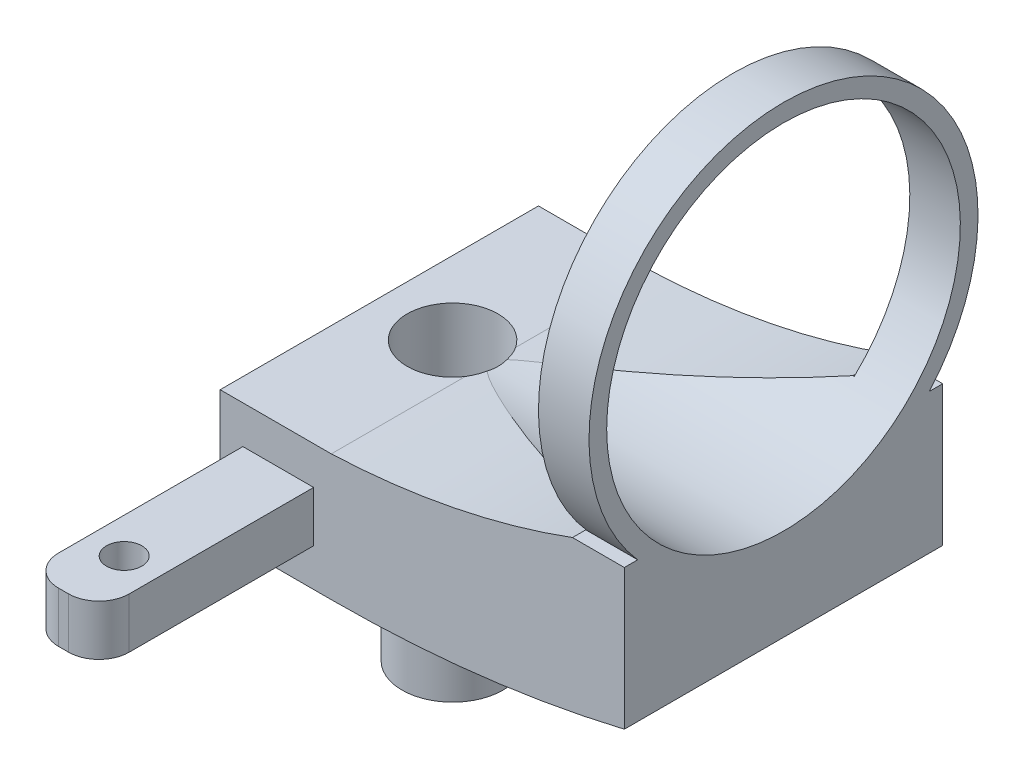
from build123d import *

# Parameters (mm, degrees)
BOSS_EXTRUDE1_DEPTH       = 48
SKETCH2_W                 = 14
SKETCH2_H                 = 10
BOSS_EXTRUDE2_DEPTH       = 50
CUT_EXTRUDE1_DEPTH        = 98
M8X1_0_TAPPED_HOLE1_D     = 7
M8X1_0_TAPPED_HOLE1_DEPTH = 10
M8X1_0_TAPPED_HOLE1_TIP   = 2.103012167
FILLET1_R                 = 6
SKETCH7_R                 = 38.5
SKETCH7_R_2               = 35
BOSS_EXTRUDE3_DEPTH       = 10
SKETCH8_R                 = 35
CUT_EXTRUDE2_DEPTH        = 90
BOSS_EXTRUDE4_DEPTH       = 5
BOSS_EXTRUDE4_DEPTH_BACK  = 10
SKETCH10_R                = 12
SKETCH10_R_2              = 9
BOSS_EXTRUDE5_START       = 25
SKETCH11_R                = 10
SKETCH11_R_2              = 9
BOSS_EXTRUDE5_DEPTH       = 25
SKETCH12_R                = 9
CUT_EXTRUDE3_DEPTH        = 42
BOSS_EXTRUDE6_DEPTH       = 7.5
BOSS_EXTRUDE7_START       = 7.5
BOSS_EXTRUDE7_DEPTH       = 7.5


with BuildPart() as part:
    # Sketch1 → Boss-Extrude1 (new body)
    with BuildSketch(Plane.XY):
        with BuildLine():
            Line((0, 0), (0, 25.00039893))
            Line((0, 25.00039893), (22, 25.00039893))
            ThreePointArc((22, 25.00039893), (51.667114877, 29.062120939), (80, 38.751440389))
            Line((80, 38.751440389), (80, 6.798665084))
            ThreePointArc((80, 6.798665084), (51.198552391, 1.705464917), (22, 0))
            Line((22, 0), (0, 0))
        make_face()
    extrude(amount=BOSS_EXTRUDE1_DEPTH)

    # Sketch2 → Boss-Extrude2 (add)
    with BuildSketch(Plane.XY.offset(48)):
        with Locations((11.5, 12.5)):
            Rectangle(SKETCH2_W, SKETCH2_H)
    boss_extrude2 = extrude(amount=BOSS_EXTRUDE2_DEPTH)

    # Mirror1: Boss-Extrude2 across plane
    add(boss_extrude2.mirror(Plane.XY.offset(24)))

    # Sketch3 → Cut-Extrude1 (cut)
    with BuildSketch(Plane(origin=(0, 0, 0), x_dir=(1, 0, 0), z_dir=(0, 1, 0))):
        Polygon((32.759036304, 13.5), (11.5, 13.5), (-23.123003772, 13.5), (-23.123003772, 84.867154232), (32.759036304, 84.867154232), align=None)
    extrude(amount=CUT_EXTRUDE1_DEPTH, mode=Mode.SUBTRACT)

    # M8x1.0 Tapped Hole1
    with Locations(Plane(origin=(11.5, 17.5, 86), x_dir=(0, 0, 1), z_dir=(0, 1, 0))):
        with Locations((0, 0)):
            Hole(M8X1_0_TAPPED_HOLE1_D / 2, depth=M8X1_0_TAPPED_HOLE1_DEPTH)
            with Locations((0, 0, -(M8X1_0_TAPPED_HOLE1_DEPTH + M8X1_0_TAPPED_HOLE1_TIP / 2))):  # 118° drill point
                Cone(0, M8X1_0_TAPPED_HOLE1_D / 2, M8X1_0_TAPPED_HOLE1_TIP, mode=Mode.SUBTRACT)

    # Fillet1
    fillet1_edges = [part.edges().sort_by_distance(p)[0] for p in [
        (18.5, 12.5, 98),
        (4.5, 12.5, 98),
    ]]
    fillet(fillet1_edges, radius=FILLET1_R)

    # Sketch7 → Boss-Extrude3 (add)
    with BuildSketch(Plane.ZY.offset(-80)):
        with Locations((24, 60.00039893)):
            Circle(SKETCH7_R)
        with Locations((24, 60.00039893)):
            Circle(SKETCH7_R_2, mode=Mode.SUBTRACT)
    extrude(amount=BOSS_EXTRUDE3_DEPTH)

    # Sketch8 → Cut-Extrude2 (cut)
    with BuildSketch(Plane.ZY.offset(-80)):
        with Locations(Location((24, 60.00039893, 0), (0, 0, 226.708192407))):
            Circle(SKETCH8_R)
    extrude(amount=CUT_EXTRUDE2_DEPTH, mode=Mode.SUBTRACT)

    # Sketch10 → Boss-Extrude4 (add, two sides: drawn at the far end of the back side and taken through both)
    with BuildSketch(Plane.XZ.offset(-BOSS_EXTRUDE4_DEPTH_BACK)):
        with Locations((14.5, 24)):
            Circle(SKETCH10_R)
        with Locations((14.5, 24)):
            Circle(SKETCH10_R_2, mode=Mode.SUBTRACT)
    extrude(amount=BOSS_EXTRUDE4_DEPTH + BOSS_EXTRUDE4_DEPTH_BACK)

    # Sketch11 → Boss-Extrude5 (add)
    with BuildSketch(Plane.XZ.offset(5).offset(BOSS_EXTRUDE5_START)):
        with Locations((14.5, 24)):
            Circle(SKETCH11_R)
        with Locations((14.5, 24)):
            Circle(SKETCH11_R_2, mode=Mode.SUBTRACT)
    extrude(amount=-BOSS_EXTRUDE5_DEPTH)

    # Sketch12 → Cut-Extrude3 (cut)
    with BuildSketch(Plane(origin=(0, 0, 0), x_dir=(-1, 0, 0), z_dir=(0, -1, 0))):
        with Locations(Location((-14.5, -24, 0), (0, 0, 180))):
            Circle(SKETCH12_R)
    extrude(amount=-CUT_EXTRUDE3_DEPTH, mode=Mode.SUBTRACT)

    # Sketch13 → Boss-Extrude6 (add)
    with BuildSketch(Plane.XY.offset(48)):
        with BuildLine():
            Line((0, 25.00039893), (0, 0))
            Line((0, 0), (22, 0))
            ThreePointArc((22, 0), (51.198552391, 1.705464917), (80, 6.798665084))
            Line((80, 6.798665084), (80, 29.896412483))
            Line((80, 29.896412483), (80, 34.524920524))
            Line((80, 34.524920524), (70, 34.524920524))
            Line((70, 34.524920524), (69.729925021, 34.524920524))
            ThreePointArc((69.729925021, 34.524920524), (46.24106465, 27.877911315), (22, 25.00039893))
            Line((22, 25.00039893), (0, 25.00039893))
        make_face()
    extrude(amount=BOSS_EXTRUDE6_DEPTH)

    # Sketch14 → Boss-Extrude7 (add)
    with BuildSketch(Plane(origin=(0, 0, 0), x_dir=(-1, 0, 0), z_dir=(0, 0, -1)).offset(BOSS_EXTRUDE7_START)):
        with BuildLine():
            Line((-80, 29.896412483), (-80, 6.798665084))
            ThreePointArc((-80, 6.798665084), (-51.198552391, 1.705464917), (-22, 0))
            Line((-22, 0), (0, 0))
            Line((0, 0), (0, 25.00039893))
            Line((0, 25.00039893), (-22, 25.00039893))
            ThreePointArc((-22, 25.00039893), (-46.24106465, 27.877911315), (-69.729925021, 34.524920524))
            Line((-69.729925021, 34.524920524), (-70, 34.524920524))
            Line((-70, 34.524920524), (-80, 34.524920524))
            Line((-80, 34.524920524), (-80, 29.896412483))
        make_face()
    extrude(amount=-BOSS_EXTRUDE7_DEPTH)


solid = part.part
